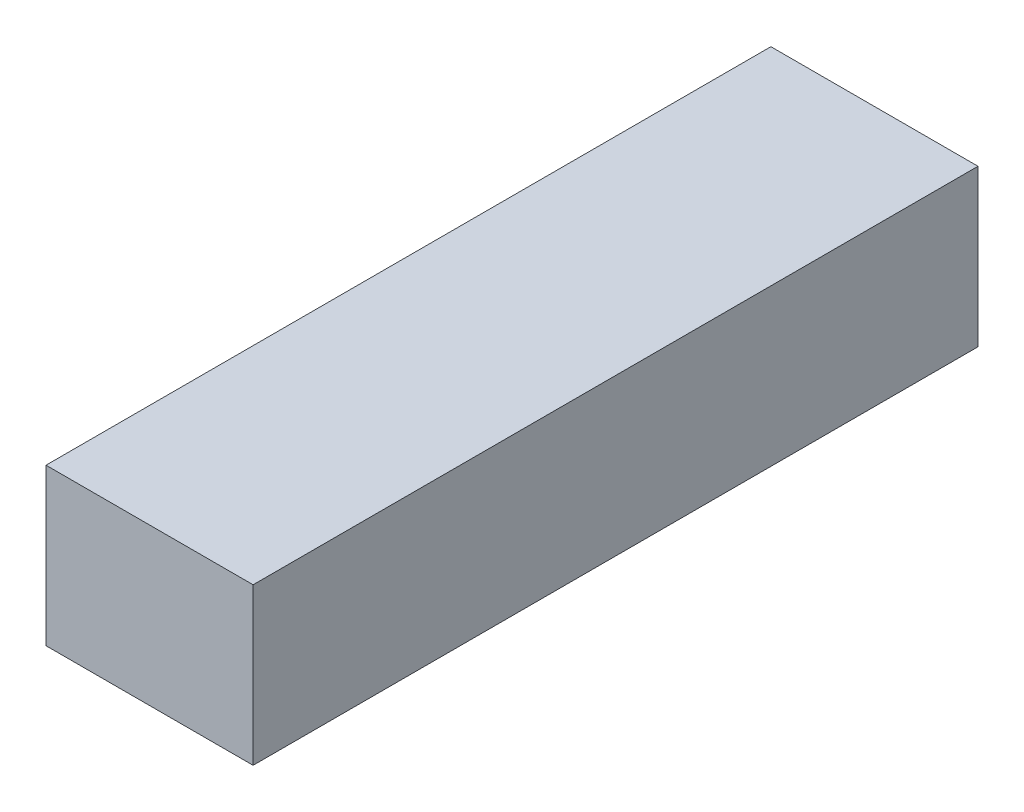
from build123d import *

# Parameters (mm, degrees)
SKETCH1_W           = 25.4
SKETCH1_H           = 88.9
BOSS_EXTRUDE1_DEPTH = 19.177


with BuildPart() as part:
    # Sketch1 → Boss-Extrude1 (new body)
    with BuildSketch(Plane(origin=(0, 0, 0), x_dir=(1, 0, 0), z_dir=(0, 1, 0))):
        with Locations((12.7, 44.45)):
            Rectangle(SKETCH1_W, SKETCH1_H)
    extrude(amount=BOSS_EXTRUDE1_DEPTH)


solid = part.part
